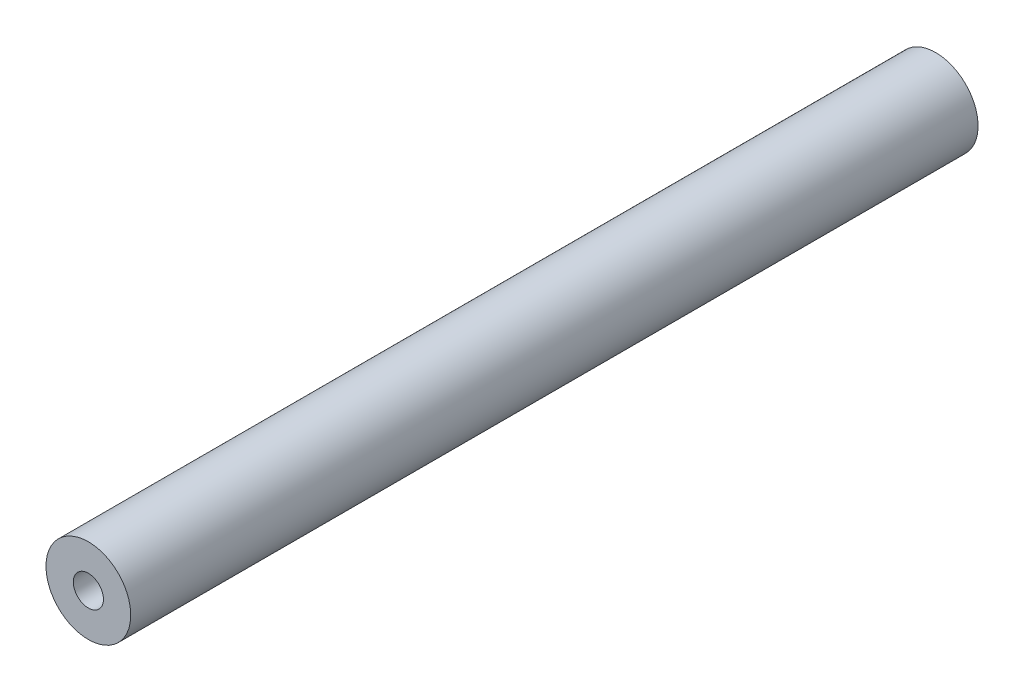
from build123d import *

# Parameters (mm, degrees)
SKIZZE1_R                       = 4.5
AUFSATZ_LINEAR_AUSTRAGEN1_DEPTH = 90
SKIZZE3_R                       = 1.6
SCHNITT_LINEAR_AUSTRAGEN1_DEPTH = 4.5
SCHNITT_LINEAR_START            = -4.5
SKIZZE4_R                       = 1.6
SCHNITT_LINEAR_AUSTRAGEN2_DEPTH = 4.5


with BuildPart() as part:
    # Skizze1 → Aufsatz-Linear austragen1 (new body)
    with BuildSketch(Plane.XY):
        with Locations(Location((0, 0, 0), (0, 0, 180))):
            Circle(SKIZZE1_R)
    extrude(amount=AUFSATZ_LINEAR_AUSTRAGEN1_DEPTH)

    # Skizze3 → Schnitt-Linear austragen1 (cut)
    with BuildSketch(Plane.XY.offset(90)):
        Circle(SKIZZE3_R)
    extrude(amount=-SCHNITT_LINEAR_AUSTRAGEN1_DEPTH, mode=Mode.SUBTRACT)

    # Skizze4 → Schnitt-Linear austragen2 (cut)
    with BuildSketch(Plane(origin=(0, 0, 0), x_dir=(-1, 0, 0), z_dir=(0, 0, -1)).offset(SCHNITT_LINEAR_START)):
        with Locations(Location((0, 0, 0), (0, 0, 180))):
            Circle(SKIZZE4_R)
    extrude(amount=SCHNITT_LINEAR_AUSTRAGEN2_DEPTH, mode=Mode.SUBTRACT)


solid = part.part
